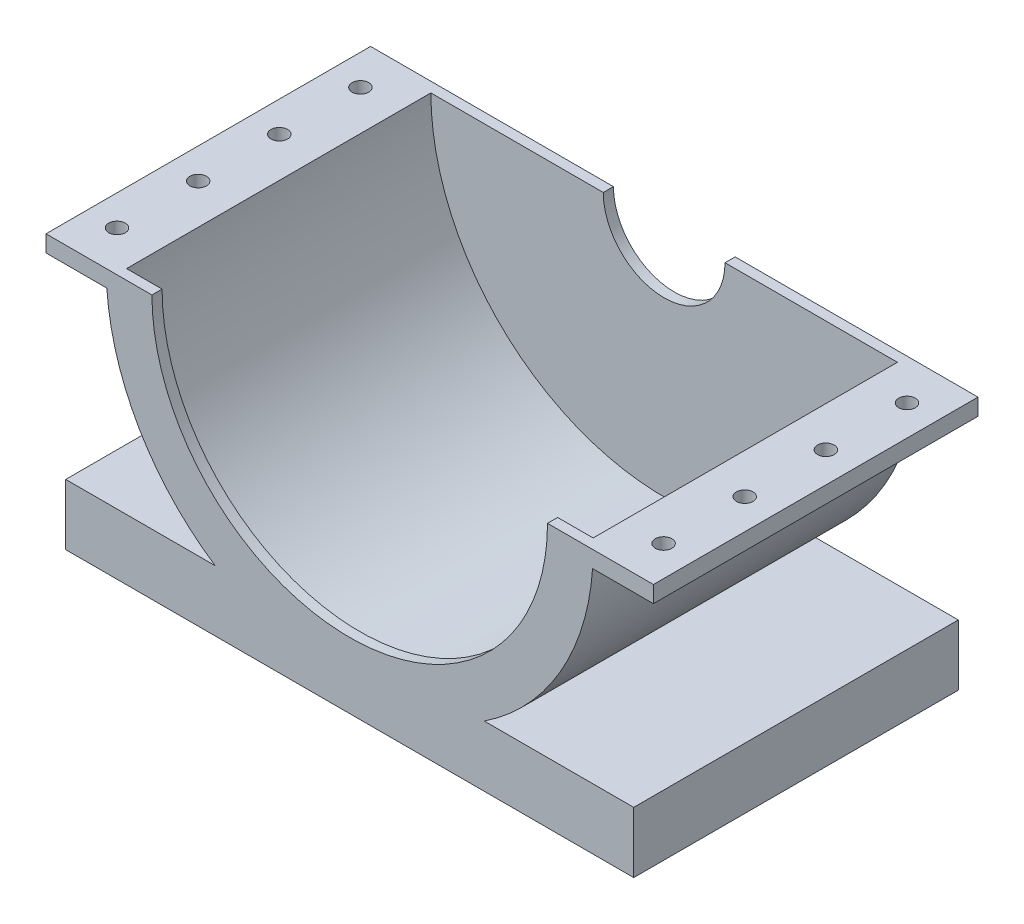
from build123d import *

# Parameters (mm, degrees)
BOSS_EXTRUDE1_DEPTH = 8
CUT_EXTRUDE1_DEPTH  = 3.75
CUT_EXTRUDE2_DEPTH  = 3.75
CUT_EXTRUDE3_DEPTH  = 3.75
SKETCH7_R           = 0.205
CUT_EXTRUDE5_DEPTH  = 2


with BuildPart() as part:
    # Sketch1 → Boss-Extrude1 (new body)
    with BuildSketch(Plane.XY):
        with BuildLine():
            Line((-7, 0), (7, 0))
            Line((7, 0), (7, 1.5))
            Line((7, 1.5), (3.31662479, 1.5))
            ThreePointArc((3.31662479, 1.5), (5.186676874, 3.483647401), (5.985975276, 6.09))
            Line((5.985975276, 6.09), (7.485975276, 6.09))
            Line((7.485975276, 6.09), (7.485975276, 6.5))
            Line((7.485975276, 6.5), (4.875, 6.5))
            Line((4.875, 6.5), (-4.875, 6.5))
            Line((-4.875, 6.5), (-7.485975276, 6.5))
            Line((-7.485975276, 6.5), (-7.485975276, 6.09))
            Line((-7.485975276, 6.09), (-5.985975276, 6.09))
            ThreePointArc((-5.985975276, 6.09), (-5.186676874, 3.483647401), (-3.31662479, 1.5))
            Line((-3.31662479, 1.5), (-7, 1.5))
            Line((-7, 1.5), (-7, 0))
        make_face()
    extrude(amount=BOSS_EXTRUDE1_DEPTH)

    # Sketch3 → Cut-Extrude1 (cut, symmetric)
    with BuildSketch(Plane.XY.offset(4)):
        with BuildLine():
            Line((5.75, 6.5), (-5.75, 6.5))
            ThreePointArc((-5.75, 6.5), (0, 0.75), (5.75, 6.5))
        make_face()
    extrude(amount=CUT_EXTRUDE1_DEPTH, both=True, mode=Mode.SUBTRACT)

    # Sketch4 → Cut-Extrude2 (cut, symmetric)
    with BuildSketch(Plane.XY.offset(8)):
        with BuildLine():
            Line((-4.875, 6.5), (4.875, 6.5))
            ThreePointArc((4.875, 6.5), (0, 1.625), (-4.875, 6.5))
        make_face()
    extrude(amount=CUT_EXTRUDE2_DEPTH, both=True, mode=Mode.SUBTRACT)

    # Sketch6 → Cut-Extrude3 (cut, symmetric)
    with BuildSketch(Plane.XY.offset(0.25)):
        with BuildLine():
            Line((-1.5, 6.5), (1.5, 6.5))
            ThreePointArc((1.5, 6.5), (0, 5), (-1.5, 6.5))
        make_face()
    extrude(amount=CUT_EXTRUDE3_DEPTH, both=True, mode=Mode.SUBTRACT)

    # Sketch7 → Cut-Extrude5 (cut)
    with BuildSketch(Plane(origin=(0, 6.5, 0), x_dir=(1, 0, 0), z_dir=(0, 1, 0))):
        with Locations(Location((6.735975276, -7, 0), (0, 0, 270))):
            Circle(SKETCH7_R)
        with Locations(Location((6.735975276, -5, 0), (0, 0, 270))):
            Circle(SKETCH7_R)
        with Locations(Location((6.735975276, -3, 0), (0, 0, 270))):
            Circle(SKETCH7_R)
        with Locations(Location((6.735975276, -1, 0), (0, 0, 270))):
            Circle(SKETCH7_R)
    cut_extrude5 = extrude(amount=-CUT_EXTRUDE5_DEPTH, mode=Mode.SUBTRACT)

    # Mirror1: Cut-Extrude5 across plane
    add(cut_extrude5.mirror(Plane(origin=(0, 0, 0), x_dir=(0, 0, 1), z_dir=(1, 0, 0))), mode=Mode.SUBTRACT)


solid = part.part
